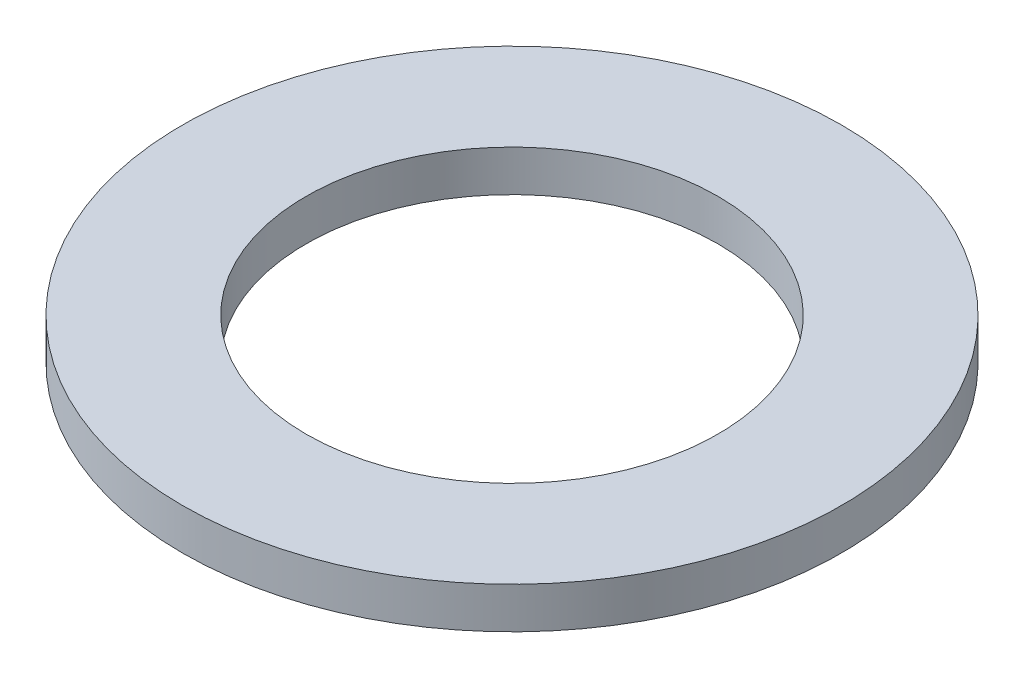
from build123d import *

# Parameters (mm, degrees)
SKETCH1_R           = 4
SKETCH1_R_2         = 2.5
BOSS_EXTRUDE1_DEPTH = 0.5


with BuildPart() as part:
    # Sketch1 → Boss-Extrude1 (new body)
    with BuildSketch(Plane(origin=(0, 0, 0), x_dir=(1, 0, 0), z_dir=(0, 1, 0))):
        with Locations(Location((0, 0, 0), (0, 0, 270))):
            Circle(SKETCH1_R)
        with Locations(Location((0, 0, 0), (0, 0, 270))):
            Circle(SKETCH1_R_2, mode=Mode.SUBTRACT)
    extrude(amount=BOSS_EXTRUDE1_DEPTH)


solid = part.part
